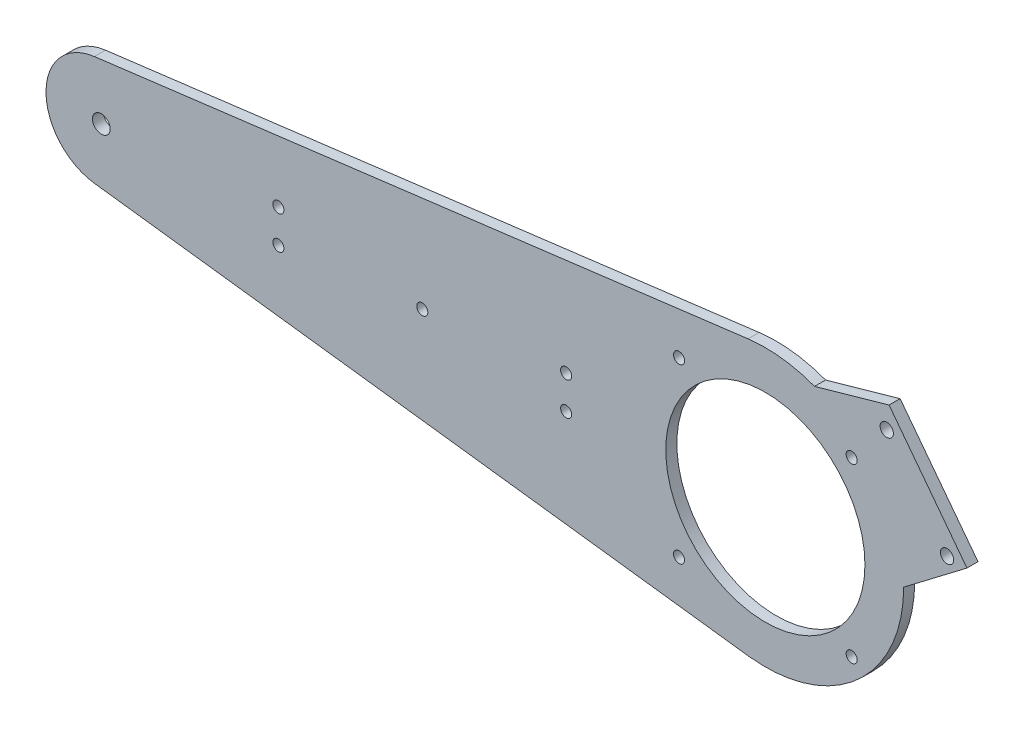
from build123d import *

# Parameters (mm, degrees)
SKETCH1_R           = 2.5
SKETCH1_R_2         = 45
SKETCH1_R_3         = 4
BOSS_EXTRUDE1_DEPTH = 5
SKETCH2_R           = 3
BOSS_EXTRUDE3_DEPTH = 5


with BuildPart() as part:
    # Sketch1 → Boss-Extrude1 (new body)
    with BuildSketch(Plane.XY):
        with BuildLine():
            Line((-303.125, -24.803918541), (-7.8125, -62.009796353))
            ThreePointArc((-7.8125, -62.009796353), (62.5, 0), (-7.8125, 62.009796353))
            Line((-7.8125, 62.009796353), (-303.125, 24.803918541))
            ThreePointArc((-303.125, 24.803918541), (-325, 0), (-303.125, -24.803918541))
        make_face()
        with Locations((-220, -7.5)):
            Circle(SKETCH1_R, mode=Mode.SUBTRACT)
        with Locations((-90, -7.5)):
            Circle(SKETCH1_R, mode=Mode.SUBTRACT)
        with Locations((-220, 7.5)):
            Circle(SKETCH1_R, mode=Mode.SUBTRACT)
        with Locations((-155, 0)):
            Circle(SKETCH1_R, mode=Mode.SUBTRACT)
        with Locations((-90, 7.5)):
            Circle(SKETCH1_R, mode=Mode.SUBTRACT)
        with Locations((39, 39)):
            Circle(SKETCH1_R, mode=Mode.SUBTRACT)
        with Locations((-39, -39)):
            Circle(SKETCH1_R, mode=Mode.SUBTRACT)
        with Locations((39, -39)):
            Circle(SKETCH1_R, mode=Mode.SUBTRACT)
        Circle(SKETCH1_R_2, mode=Mode.SUBTRACT)
        with Locations((-39, 39)):
            Circle(SKETCH1_R, mode=Mode.SUBTRACT)
        with Locations((-300, 0)):
            Circle(SKETCH1_R_3, mode=Mode.SUBTRACT)
    extrude(amount=BOSS_EXTRUDE1_DEPTH)

    # Sketch2 → Boss-Extrude3 (add)
    with BuildSketch(Plane(origin=(0, 0, 0), x_dir=(-1, 0, 0), z_dir=(0, 0, -1))):
        Polygon((-62.5, 0), (-91.073673697, 21.751815091), (-55.889899017, 67.970013109), (-22.218770371, 58.417259806), (-51.948744274, 34.750222566), align=None)
        with Locations((-54.840808576, 57.745505577)):
            Circle(SKETCH2_R, mode=Mode.SUBTRACT)
        with Locations((-82.098001573, 21.939843596)):
            Circle(SKETCH2_R, mode=Mode.SUBTRACT)
    extrude(amount=-BOSS_EXTRUDE3_DEPTH)


solid = part.part
